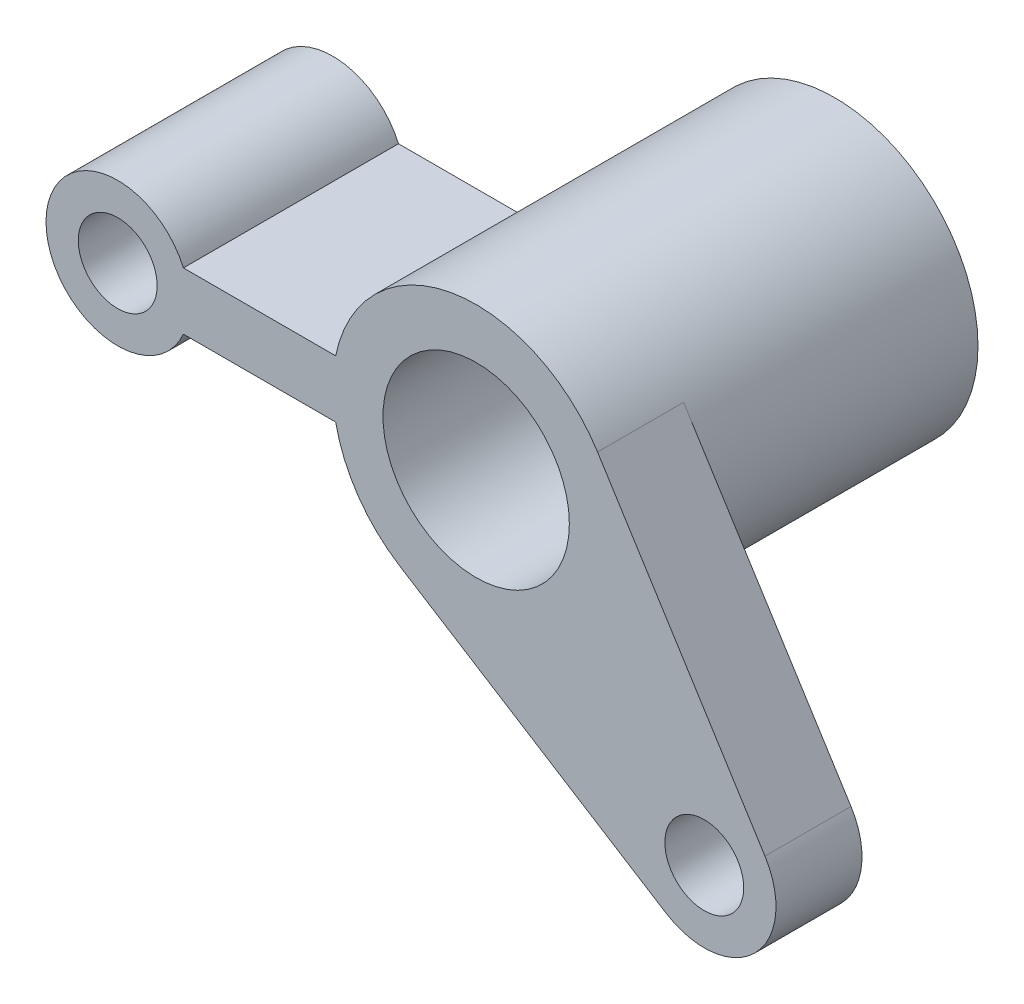
from build123d import *

# Parameters (mm, degrees)
SKETCH_2_R          = 20
EXTRUDE_2_DEPTH     = 50
SKETCH_3_R          = 10
SKETCH_3_W          = 50
SKETCH_3_H          = 8
EXTRUDE_3_DEPTH     = 30
EXTRUDE_START       = -12
SKETCH_4_R          = 10
EXTRUDE_4_DEPTH     = 12
SKETCH_5_R          = 13
SKETCH_5_R_2        = 5.5
CUT_EXTRUDE_1_DEPTH = 89.593995864


with BuildPart() as part:
    # Эскиз2 → Бобышка-Вытянуть2 (new body)
    with BuildSketch(Plane.XY):
        Circle(SKETCH_2_R)
    extrude(amount=EXTRUDE_2_DEPTH)

    # Эскиз3 → Бобышка-Вытянуть3 (add)
    with BuildSketch(Plane.XY.offset(50)):
        with Locations((-50, 0)):
            Circle(SKETCH_3_R)
        with Locations((-25, 0)):
            Rectangle(SKETCH_3_W, SKETCH_3_H)
    extrude(amount=-EXTRUDE_3_DEPTH)

    # Эскиз4 → Бобышка-Вытянуть4 (add)
    with BuildSketch(Plane.XY.offset(50).offset(EXTRUDE_START)):
        with BuildLine():
            Line((-10.645829468, -16.931223079), (26.496890419, -40.285416693))
            ThreePointArc((26.496890419, -40.285416693), (24.748737342, -24.748737342), (40.285416693, -26.496890419))
            Line((40.285416693, -26.496890419), (16.931223079, 10.645829468))
            ThreePointArc((16.931223079, 10.645829468), (14.142135624, -14.142135624), (-10.645829468, -16.931223079))
        make_face()
        with Locations((31.819805153, -31.819805153)):
            Circle(SKETCH_4_R)
    extrude(amount=EXTRUDE_4_DEPTH)

    # Эскиз5 → Вырез-Вытянуть1 (cut, through all)
    with BuildSketch(Plane.XY.offset(50)):
        Circle(SKETCH_5_R)
        with Locations((-50, 0)):
            Circle(SKETCH_5_R_2)
        with Locations((31.819805153, -31.819805153)):
            Circle(SKETCH_5_R_2)
    extrude(amount=-CUT_EXTRUDE_1_DEPTH, mode=Mode.SUBTRACT)


solid = part.part
